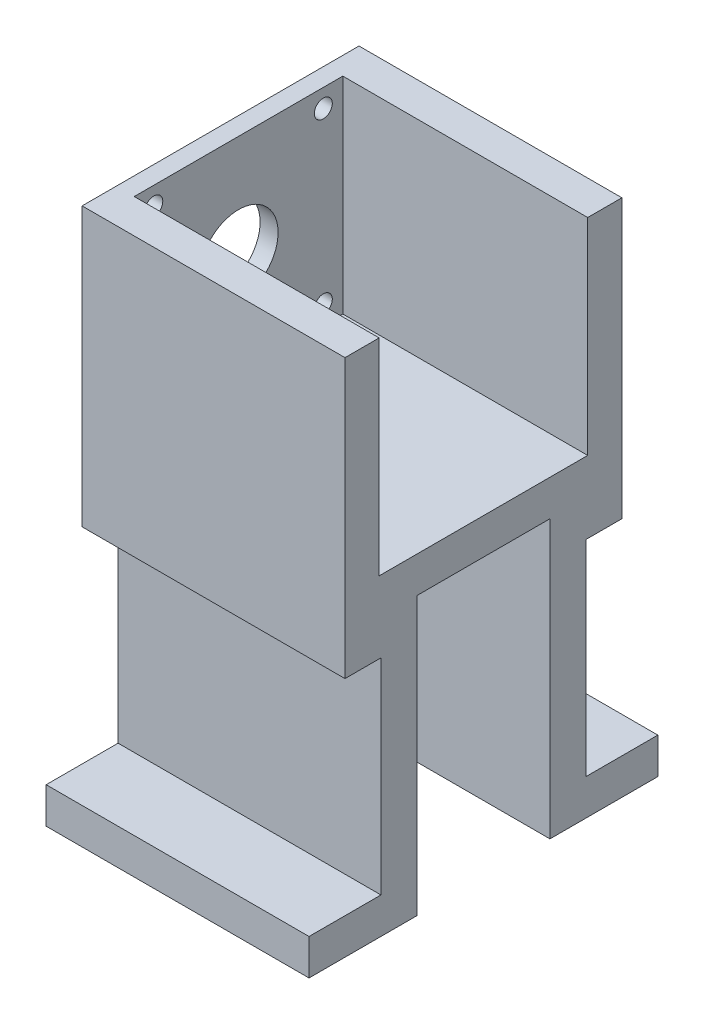
from build123d import *

# Parameters (mm, degrees)
BOSS_EXTRUDE1_DEPTH = 57
SKETCH4_R           = 11
SKETCH4_R_2         = 2.5
CUT_EXTRUDE3_DEPTH  = 43
SKETCH5_W           = 73.1
SKETCH5_H           = 10
BOSS_EXTRUDE2_DEPTH = 77.1
SKETCH6_W           = 73.1
SKETCH6_H           = 10
BOSS_EXTRUDE3_DEPTH = 20
SKETCH8_W           = 73.1
SKETCH8_H           = 77.3
BOSS_EXTRUDE4_DEPTH = 10
SKETCH9_W           = 68.1
SKETCH9_H           = 57.3
CUT_EXTRUDE4_DEPTH  = 0.5


with BuildPart() as part:
    # Sketch1 → Boss-Extrude1 (new body)
    with BuildSketch(Plane.XY):
        Polygon((-34.05, 0), (34.05, 0), (34.05, -10), (29.05, -10), (-34.05, -10), (-39.05, -10), (-39.05, 57.3), (-34.05, 57.3), align=None)
    extrude(amount=BOSS_EXTRUDE1_DEPTH)

    # Sketch4 → Cut-Extrude3 (cut)
    with BuildSketch(Plane.ZY.offset(39.05)):
        with Locations(Location((28.5, 28.65, 0), (0, 0, 270))):
            Circle(SKETCH4_R)
        with Locations(Location((52.07, 52.22, 0), (0, 0, 270))):
            Circle(SKETCH4_R_2)
        with Locations(Location((4.93, 52.22, 0), (0, 0, 270))):
            Circle(SKETCH4_R_2)
        with Locations(Location((52.07, 5.08, 0), (0, 0, 270))):
            Circle(SKETCH4_R_2)
        with Locations(Location((4.93, 5.08, 0), (0, 0, 270))):
            Circle(SKETCH4_R_2)
    extrude(amount=-CUT_EXTRUDE3_DEPTH, mode=Mode.SUBTRACT)

    # Sketch5 → Boss-Extrude2 (add)
    with BuildSketch(Plane.XZ.offset(10)):
        with Locations((-2.5, 5)):
            Rectangle(SKETCH5_W, SKETCH5_H)
        with Locations((-2.5, 52)):
            Rectangle(SKETCH5_W, SKETCH5_H)
    extrude(amount=BOSS_EXTRUDE2_DEPTH)

    # Sketch6 → Boss-Extrude3 (add)
    with BuildSketch(Plane(origin=(0, 0, 0), x_dir=(-1, 0, 0), z_dir=(0, 0, -1))):
        with Locations((2.5, -82.1)):
            Rectangle(SKETCH6_W, SKETCH6_H)
    boss_extrude3 = extrude(amount=BOSS_EXTRUDE3_DEPTH)

    # Sketch8 → Boss-Extrude4 (add)
    with BuildSketch(Plane(origin=(0, 0, 0), x_dir=(-1, 0, 0), z_dir=(0, 0, -1))):
        with Locations((2.5, 18.65)):
            Rectangle(SKETCH8_W, SKETCH8_H)
    boss_extrude4 = extrude(amount=BOSS_EXTRUDE4_DEPTH)

    # Mirror2: Boss-Extrude4 across plane
    add(boss_extrude4.mirror(Plane.XY.offset(28.5)))

    # Mirror3: Boss-Extrude3 across plane
    add(boss_extrude3.mirror(Plane.XY.offset(28.5)))

    # Sketch9 → Cut-Extrude4 (cut)
    with BuildSketch(Plane(origin=(0, 0, 57), x_dir=(-1, 0, 0), z_dir=(0, 0, -1))):
        with Locations((0, 28.65)):
            Rectangle(SKETCH9_W, SKETCH9_H)
    cut_extrude4 = extrude(amount=-CUT_EXTRUDE4_DEPTH, mode=Mode.SUBTRACT)

    # Mirror4: Cut-Extrude4 across plane
    add(cut_extrude4.mirror(Plane.XY.offset(28.5)), mode=Mode.SUBTRACT)


solid = part.part
